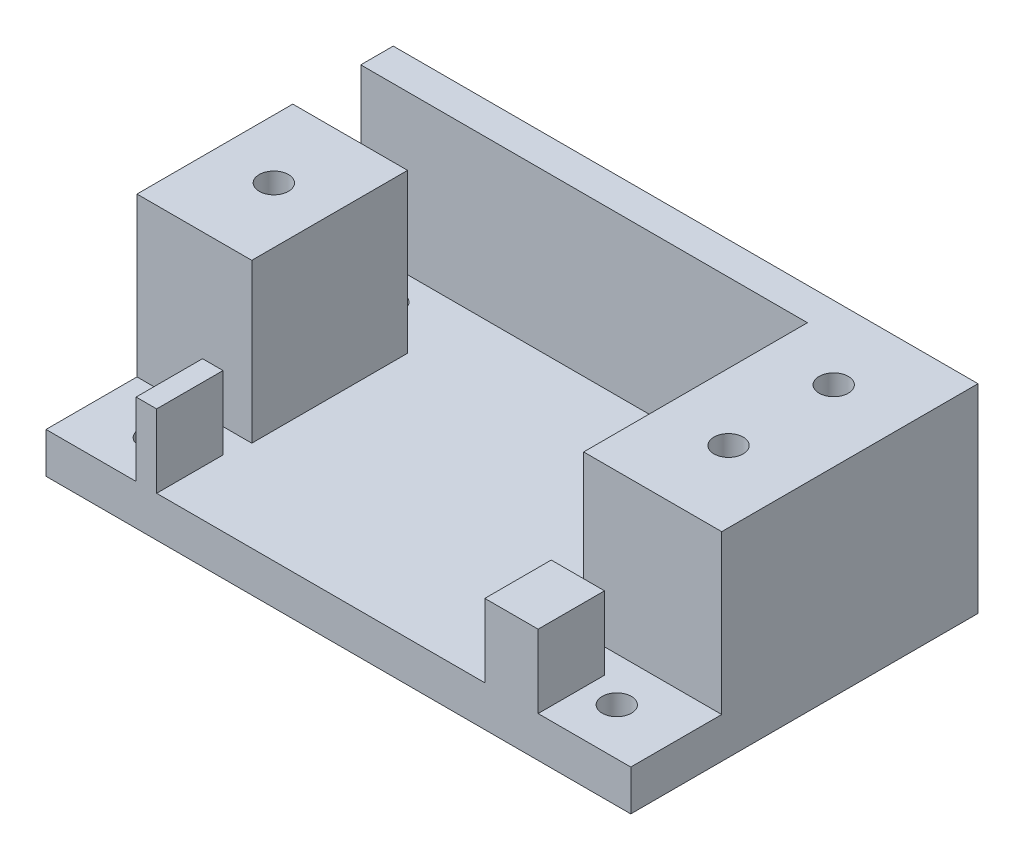
from build123d import *

# Parameters (mm, degrees)
SKETCH2_W                = 72
SKETCH2_H                = 40
BOSS_EXTRUDE1_DEPTH      = 5
BOSS_EXTRUDE2_DEPTH      = 19.5
BOSS_EXTRUDE2_DEPTH_BACK = 5
SKETCH3_W                = 14.135898402
SKETCH3_H                = 19.186853455
CUT_EXTRUDE1_START       = 19.5
SKETCH4_R                = 1.8
CUT_EXTRUDE1_DEPTH       = 30
SKETCH8_W                = 2.527236714
SKETCH8_H                = 8.177193873
SKETCH8_W_2              = 6.563624393
BOSS_EXTRUDE7_DEPTH      = 9
SKETCH9_R                = 1.8
CUT_EXTRUDE2_DEPTH       = 53


with BuildPart() as part:
    # Sketch2 → Boss-Extrude1 (new body)
    with BuildSketch(Plane(origin=(0, 0, 0), x_dir=(1, 0, 0), z_dir=(0, 1, 0))):
        with Locations((36, 20)):
            Rectangle(SKETCH2_W, SKETCH2_H)
    extrude(amount=BOSS_EXTRUDE1_DEPTH)

    # Sketch3 → Boss-Extrude2 (add, two sides: drawn at the far end of the back side and taken through both)
    with BuildSketch(Plane(origin=(0, 5, 0), x_dir=(1, 0, 0), z_dir=(0, 1, 0)).offset(-BOSS_EXTRUDE2_DEPTH_BACK)):
        with Locations((7.067949201, 20.793426728)):
            Rectangle(SKETCH3_W, SKETCH3_H)
        Polygon((55, 38.754979203), (55, 11.2), (72, 11.2), (72, 42.754979203), (0, 42.754979203), (0, 38.754979203), align=None)
    extrude(amount=BOSS_EXTRUDE2_DEPTH + BOSS_EXTRUDE2_DEPTH_BACK)

    # Sketch4 → Cut-Extrude1 (cut)
    with BuildSketch(Plane(origin=(0, 5, 0), x_dir=(1, 0, 0), z_dir=(0, 1, 0)).offset(CUT_EXTRUDE1_START)):
        with Locations(Location((7.5, 34.648486257, 0), (0, 0, 90))):
            Circle(SKETCH4_R)
        with Locations(Location((7.5, 5.778304463, 0), (0, 0, 90))):
            Circle(SKETCH4_R)
        with Locations(Location((64.5, 5.778304463, 0), (0, 0, 90))):
            Circle(SKETCH4_R)
    extrude(amount=-CUT_EXTRUDE1_DEPTH, mode=Mode.SUBTRACT)

    # Sketch8 → Boss-Extrude7 (add)
    with BuildSketch(Plane(origin=(0, 5, 0), x_dir=(1, 0, 0), z_dir=(0, 1, 0))):
        with Locations((12.356862163, 4.088596937)):
            Rectangle(SKETCH8_W, SKETCH8_H)
        with Locations((57.312199978, 4.088596937)):
            Rectangle(SKETCH8_W_2, SKETCH8_H)
    extrude(amount=BOSS_EXTRUDE7_DEPTH)

    # Sketch9 → Cut-Extrude2 (cut)
    with BuildSketch(Plane(origin=(0, 24.5, 0), x_dir=(1, 0, 0), z_dir=(0, 1, 0))):
        with Locations(Location((7.244076977, 20.809705714, 0), (0, 0, 270))):
            Circle(SKETCH9_R)
        with Locations(Location((63.234445615, 20.809705714, 0), (0, 0, 270))):
            Circle(SKETCH9_R)
        with Locations(Location((63.234445615, 33.7549792, 0), (0, 0, 270))):
            Circle(SKETCH9_R)
    extrude(amount=-CUT_EXTRUDE2_DEPTH, mode=Mode.SUBTRACT)


solid = part.part
